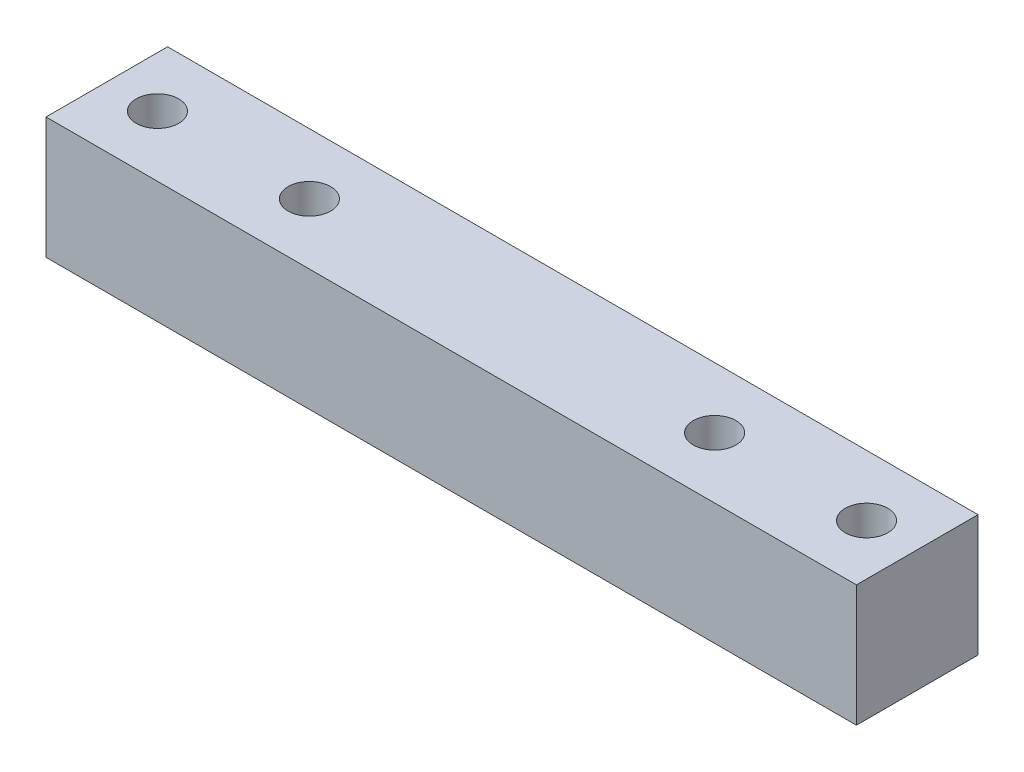
from build123d import *

# Parameters (mm, degrees)
SKETCH1_W           = 80
SKETCH1_H           = 12
BOSS_EXTRUDE1_DEPTH = 12
SKETCH2_R           = 2.1
CUT_EXTRUDE1_DEPTH  = 43.190046219
CUT_EXTRUDE8_DEPTH  = 0.2


with BuildPart() as part:
    # Sketch1 → Boss-Extrude1 (new body)
    with BuildSketch(Plane(origin=(0, 0, 0), x_dir=(1, 0, 0), z_dir=(0, 1, 0))):
        Rectangle(SKETCH1_W, SKETCH1_H)
    extrude(amount=BOSS_EXTRUDE1_DEPTH)

    # Sketch2 → Cut-Extrude1 (cut, through all)
    with BuildSketch(Plane(origin=(0, 12, 0), x_dir=(1, 0, 0), z_dir=(0, 1, 0))):
        with Locations(Location((35, 0, 0), (0, 0, 270))):
            Circle(SKETCH2_R)
        with Locations(Location((20, 0, 0), (0, 0, 270))):
            Circle(SKETCH2_R)
        with Locations(Location((-20, 0, 0), (0, 0, 90))):
            Circle(SKETCH2_R)
        with Locations(Location((-35, 0, 0), (0, 0, 90))):
            Circle(SKETCH2_R)
    extrude(amount=-CUT_EXTRUDE1_DEPTH, mode=Mode.SUBTRACT)

    # Sketch3 → Cut-Extrude8 (cut)
    with BuildSketch(Plane.ZY.offset(40)):
        Polygon((-3, 0), (0, 10.963509299), (3, 0), align=None)
    extrude(amount=-CUT_EXTRUDE8_DEPTH, mode=Mode.SUBTRACT)


solid = part.part
